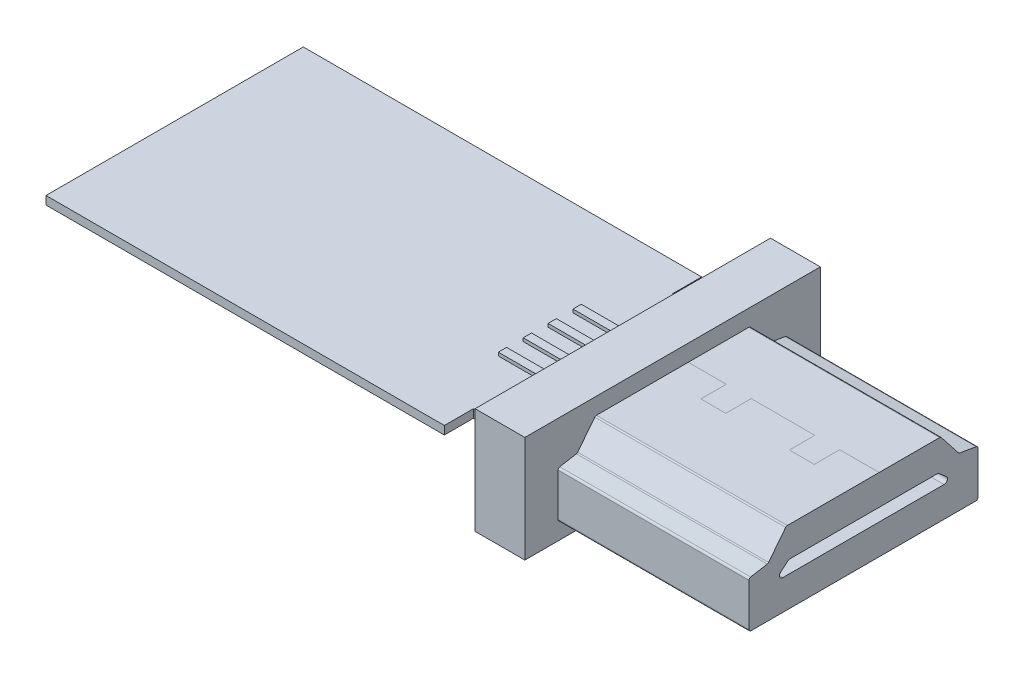
from build123d import *

# Parameters (mm, degrees)
BOSS_EXTRUDE1_DEPTH = 11.5
SKETCH2_W           = 17.8
SKETCH2_H           = 6.4
BOSS_EXTRUDE2_DEPTH = 3
BOSS_EXTRUDE3_DEPTH = 0.25
SKETCH4_W           = 5
SKETCH4_H           = 0.5
BOSS_EXTRUDE4_DEPTH = 0.2
FILLET1_R           = 0.125
CUT_EXTRUDE1_DEPTH  = 6.5
FILLET2_R           = 0.2


with BuildPart() as part:
    # Sketch1 → Boss-Extrude1 (new body)
    with BuildSketch(Plane(origin=(0, 0, 0), x_dir=(0, 0, -1), z_dir=(1, 0, 0))):
        Polygon((0, 2.8), (1.152683079, 3.000553531), (2.25, 4.4), (11.55, 4.4), (12.647316921, 3.000553531), (13.8, 2.8), (13.8, 0), (0, 0), align=None)
    extrude(amount=BOSS_EXTRUDE1_DEPTH)

    # Sketch2 → Boss-Extrude2 (add)
    with BuildSketch(Plane.ZY):
        with Locations((-6.9, 2.2)):
            Rectangle(SKETCH2_W, SKETCH2_H)
    extrude(amount=BOSS_EXTRUDE2_DEPTH)

    # Sketch3 → Boss-Extrude3 (add, symmetric)
    with BuildSketch(Plane(origin=(0, 2.2, 0), x_dir=(1, 0, 0), z_dir=(0, 1, 0))):
        Polygon((-3, 12.9), (-6, 12.9), (-6, 14.65), (-30, 14.65), (-30, -0.85), (-6, -0.85), (-6, 0.9), (-3, 0.9), align=None)
    extrude(amount=BOSS_EXTRUDE3_DEPTH, both=True)

    # Sketch4 → Boss-Extrude4 (add)
    with BuildSketch(Plane(origin=(0, 2.45, 0), x_dir=(1, 0, 0), z_dir=(0, 1, 0))):
        with Locations((-5.5, 9.15)):
            Rectangle(SKETCH4_W, SKETCH4_H)
        with Locations((-5.5, 7.65)):
            Rectangle(SKETCH4_W, SKETCH4_H)
        with Locations((-5.5, 6.15)):
            Rectangle(SKETCH4_W, SKETCH4_H)
        with Locations((-5.5, 4.65)):
            Rectangle(SKETCH4_W, SKETCH4_H)
    boss_extrude4 = extrude(amount=BOSS_EXTRUDE4_DEPTH)

    # Mirror1: Boss-Extrude4 across plane
    add(boss_extrude4.mirror(Plane.ZX.offset(2.2)))

    # Fillet1
    fillet1_edges = [part.edges().sort_by_distance(p)[0] for p in [
        (5.75, 2.8, 0),
        (5.75, 3.000553531, -1.152683079),
        (5.75, 4.4, -2.25),
        (5.75, 4.4, -11.55),
        (5.75, 3.000553531, -12.647316921),
        (5.75, 2.8, -13.8),
        (5.75, 0, -13.8),
        (5.75, 0, 0),
    ]]
    fillet(fillet1_edges, radius=FILLET1_R)

    # Sketch5 → Cut-Extrude1 (cut)
    with BuildSketch(Plane(origin=(11.5, 0, 0), x_dir=(0, 0, -1), z_dir=(1, 0, 0))):
        Polygon((2.4, 2.5825), (1.5, 1.8175), (12.3, 1.8175), (11.4, 2.5825), align=None)
    extrude(amount=-CUT_EXTRUDE1_DEPTH, mode=Mode.SUBTRACT)

    # Fillet2
    fillet2_edges = [part.edges().sort_by_distance(p)[0] for p in [
        (8.25, 1.8175, -1.5),
        (8.25, 1.8175, -12.3),
        (8.25, 2.5825, -11.4),
        (8.25, 2.5825, -2.4),
    ]]
    fillet(fillet2_edges, radius=FILLET2_R)


solid = part.part
